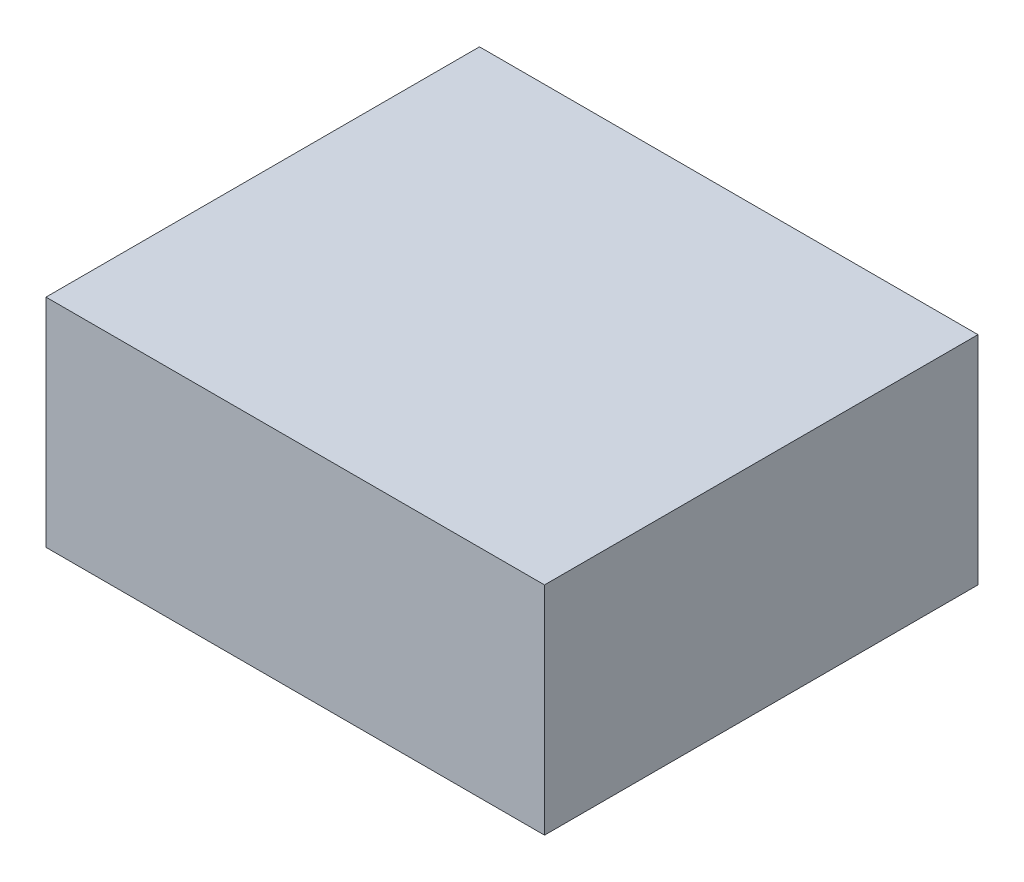
from build123d import *

# Parameters (mm, degrees)
SKETCH1_W           = 23
SKETCH1_H           = 20
BOSS_EXTRUDE1_DEPTH = 10


with BuildPart() as part:
    # Sketch1 → Boss-Extrude1 (new body)
    with BuildSketch(Plane(origin=(0, 0, 0), x_dir=(1, 0, 0), z_dir=(0, 1, 0))):
        with Locations((11.5, 10)):
            Rectangle(SKETCH1_W, SKETCH1_H)
    extrude(amount=BOSS_EXTRUDE1_DEPTH)


solid = part.part
